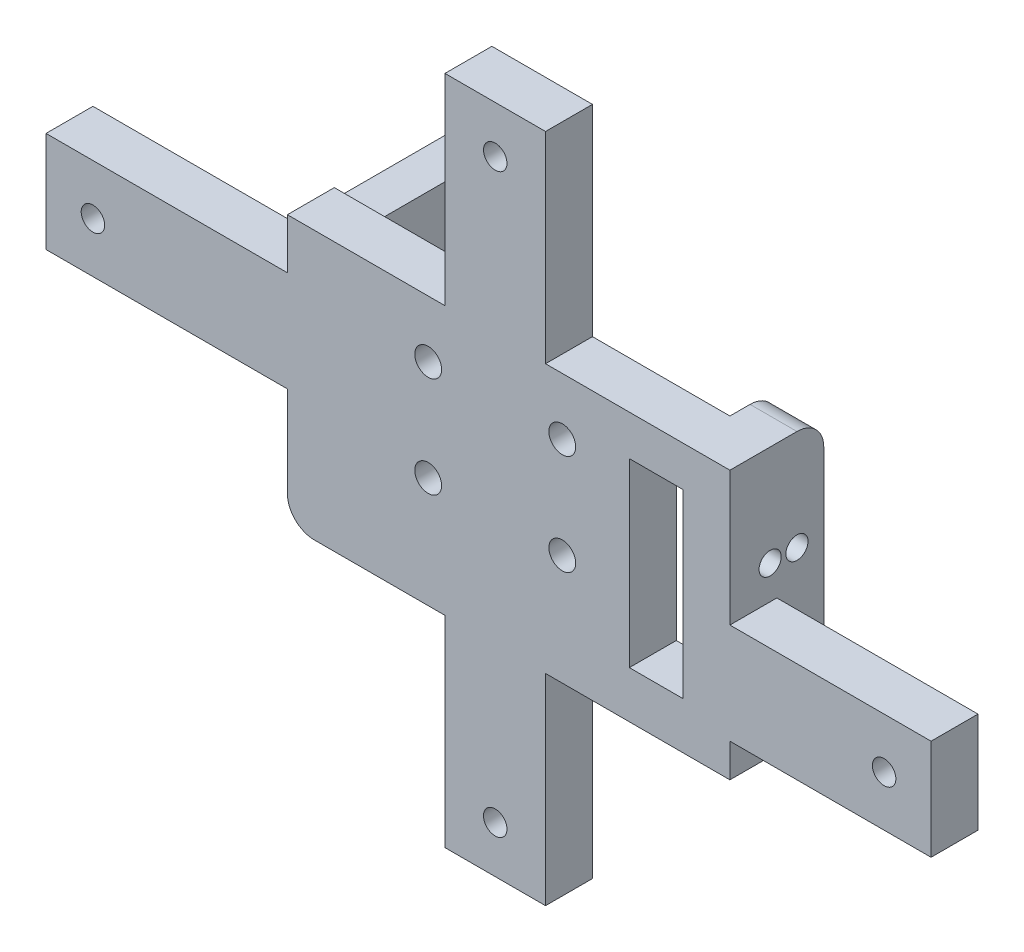
from build123d import *

# Parameters (mm, degrees)
EXTRUDE_START       = 24.2
EXTRUDE_1_DEPTH     = 6
SKETCH_5_W          = 40
SKETCH_5_H          = 34
SKETCH_5_R          = 2
EXTRUDE_2_DEPTH     = 7
EXTRUDE_START_2     = -9.8
SKETCH_7_R          = 4.1
EXTRUDE_3_DEPTH     = 7
EXTRUDE_START_3     = -53
SKETCH_9_R          = 1.65
EXTRUDE_4_DEPTH     = 6
EXTRUDE_START_4     = -22.5
EXTRUDE_5_DEPTH     = 7
EXTRUDE_START_5     = 28
SKETCH_14_R         = 1.65
EXTRUDE_8_DEPTH     = 7
SKETCH_15_W         = 8
SKETCH_15_H         = 7
EXTRUDE_9_DEPTH     = 7
SKETCH_17_R         = 3
SKETCH_17_R_2       = 1.5
EXTRUDE_11_DEPTH    = 0.5
SKETCH_18_W         = 50.26694464
SKETCH_18_H         = 22.871129036
CUT_EXTRUDE_1_DEPTH = 50
SKETCH_19_W         = 15
SKETCH_19_H         = 30
SKETCH_19_R         = 1.75
SKETCH_19_W_2       = 30
SKETCH_19_H_2       = 15
EXTRUDE_12_DEPTH    = 7


with BuildPart() as part:
    # 草图4 → 凸台-拉伸1 (new body)
    with BuildSketch(Plane(origin=(0, 0, 0), x_dir=(1, 0, 0), z_dir=(0, 1, 0)).offset(EXTRUDE_START)):
        Polygon((-21, 22.5), (-28, 22.5), (-28, 29.5), (28, 29.5), (28, 22.5), (21, 22.5), align=None)
    extrude(amount=EXTRUDE_1_DEPTH)

    # 草图5 → 凸台-拉伸2 (add)
    with BuildSketch(Plane(origin=(0, 0, -29.5), x_dir=(-1, 0, 0), z_dir=(0, 0, -1))):
        with Locations((0, 7.2)):
            Rectangle(SKETCH_5_W, SKETCH_5_H)
        with Locations((-10, 21.7)):
            Circle(SKETCH_5_R, mode=Mode.SUBTRACT)
        with Locations(Location((10, 21.7, 0), (0, 0, 180))):
            Circle(SKETCH_5_R, mode=Mode.SUBTRACT)
        with Locations((10, 6.7)):
            Circle(SKETCH_5_R, mode=Mode.SUBTRACT)
        with Locations(Location((-10, 6.7, 0), (0, 0, 180))):
            Circle(SKETCH_5_R, mode=Mode.SUBTRACT)
    extrude(amount=-EXTRUDE_2_DEPTH)

    # 草图7 → 凸台-拉伸3 (add)
    with BuildSketch(Plane(origin=(0, 0, 0), x_dir=(1, 0, 0), z_dir=(0, 1, 0)).offset(EXTRUDE_START_2)):
        with BuildLine():
            Line((20, 22.5), (-20, 22.5))
            Line((-20, 22.5), (-20, 2.5))
            ThreePointArc((-20, 2.5), (-19.121320344, 0.378679656), (-17, -0.5))
            Line((-17, -0.5), (17, -0.5))
            ThreePointArc((17, -0.5), (19.121320344, 0.378679656), (20, 2.5))
            Line((20, 2.5), (20, 22.5))
        make_face()
        with Locations(Location((10, 10, 0), (0, 0, 90))):
            Circle(SKETCH_7_R, mode=Mode.SUBTRACT)
    extrude(amount=EXTRUDE_3_DEPTH)



with BuildPart() as body_2:
    # 草图9 → 凸台-拉伸4 (new body)
    with BuildSketch(Plane(origin=(22, 25.2, -43.868265324), x_dir=(0, 0, 1), z_dir=(1, 0, 0)).offset(EXTRUDE_START_3)):
        with BuildLine():
            Line((-8.631734676, 2.5), (21.368265324, 2.5))
            Line((21.368265324, 2.5), (21.368265324, 17.5))
            Line((21.368265324, 17.5), (-8.631734676, 17.5))
            ThreePointArc((-8.631734676, 17.5), (-16.131734676, 10), (-8.631734676, 2.5))
        make_face()
        with Locations(Location((-8.631734676, 10, 0), (0, 0, 270))):
            Circle(SKETCH_9_R, mode=Mode.SUBTRACT)
    extrude(amount=-EXTRUDE_4_DEPTH)


with BuildPart() as part_1:
    add(part.part)

    add(body_2.part)  # 凸台-拉伸5 merges body 2
    # 草图10 → 凸台-拉伸5 (add)
    with BuildSketch(Plane.XY.offset(EXTRUDE_START_4)):
        with BuildLine():
            Line((-31, 30.2), (-20, 30.2))
            Line((-20, 30.2), (-20, -9.8))
            Line((-20, -9.8), (-27, -9.8))
            ThreePointArc((-27, -9.8), (-29.828427125, -8.628427125), (-31, -5.8))
            Line((-31, -5.8), (-31, 30.2))
        make_face()
    extrude(amount=-EXTRUDE_5_DEPTH)

    # 草图14 → 凸台-拉伸8 (add)
    with BuildSketch(Plane(origin=(0, 0, 0), x_dir=(0, 0, -1), z_dir=(1, 0, 0)).offset(EXTRUDE_START_5)):
        with BuildLine():
            Line((22.5, 30.2), (32.5, 30.2))
            ThreePointArc((32.5, 30.2), (35.328427125, 29.028427125), (36.5, 26.2))
            Line((36.5, 26.2), (36.5, -5.8))
            ThreePointArc((36.5, -5.8), (35.328427125, -8.628427125), (32.5, -9.8))
            Line((32.5, -9.8), (22.5, -9.8))
            Line((22.5, -9.8), (22.5, 30.2))
        make_face()
        with Locations((28.5, 15.2)):
            Circle(SKETCH_14_R, mode=Mode.SUBTRACT)
        with Locations((32.5, 15.2)):
            Circle(SKETCH_14_R, mode=Mode.SUBTRACT)
    extrude(amount=EXTRUDE_8_DEPTH)

    # 草图15 → 凸台-拉伸9 (add)
    with BuildSketch(Plane(origin=(0, 0, 0), x_dir=(1, 0, 0), z_dir=(0, 1, 0)).offset(EXTRUDE_START_2)):
        with Locations((24, 26)):
            Rectangle(SKETCH_15_W, SKETCH_15_H)
    extrude(amount=EXTRUDE_9_DEPTH)

    # 草图17 → 凸台-拉伸11 (add)
    with BuildSketch(Plane(origin=(-31, 0, 0), x_dir=(0, 0, -1), z_dir=(1, 0, 0))):
        with Locations(Location((52.5, 15.2, 0), (0, 0, 90))):
            Circle(SKETCH_17_R)
        with Locations(Location((52.5, 15.2, 0), (0, 0, 90))):
            Circle(SKETCH_17_R_2, mode=Mode.SUBTRACT)
    extrude(amount=EXTRUDE_11_DEPTH)

    # 草图18 → 切除-拉伸1 (cut)
    with BuildSketch(Plane.XY.offset(-22.5)):
        Rectangle(SKETCH_18_W, SKETCH_18_H)
    extrude(amount=CUT_EXTRUDE_1_DEPTH, mode=Mode.SUBTRACT)

    # 草图19 → 凸台-拉伸12 (add)
    # profile 1 of 4: a face of its own
    with BuildSketch(Plane.XY.offset(EXTRUDE_START_4)):
        with Locations((0, 45.2)):
            Rectangle(SKETCH_19_W, SKETCH_19_H)
        with Locations((0, 53.2)):
            Circle(SKETCH_19_R, mode=Mode.SUBTRACT)
    # profile 2 of 4: a face of its own
    with BuildSketch(Plane.XY.offset(EXTRUDE_START_4)):
        with Locations((-52, 15.2)):
            Rectangle(SKETCH_19_W_2, SKETCH_19_H_2)
        with Locations((-60, 15.2)):
            Circle(SKETCH_19_R, mode=Mode.SUBTRACT)
    # profile 3 of 4: a face of its own
    with BuildSketch(Plane.XY.offset(EXTRUDE_START_4)):
        with Locations((50, 2.7)):
            Rectangle(SKETCH_19_W_2, SKETCH_19_H_2)
        with Locations((58, 2.7)):
            Circle(SKETCH_19_R, mode=Mode.SUBTRACT)
    # profile 4 of 4: a face of its own
    with BuildSketch(Plane.XY.offset(EXTRUDE_START_4)):
        with Locations((0, -24.8)):
            Rectangle(SKETCH_19_W, SKETCH_19_H)
        with Locations((0, -32.8)):
            Circle(SKETCH_19_R, mode=Mode.SUBTRACT)
    extrude(amount=-EXTRUDE_12_DEPTH)


solid = part_1.part
